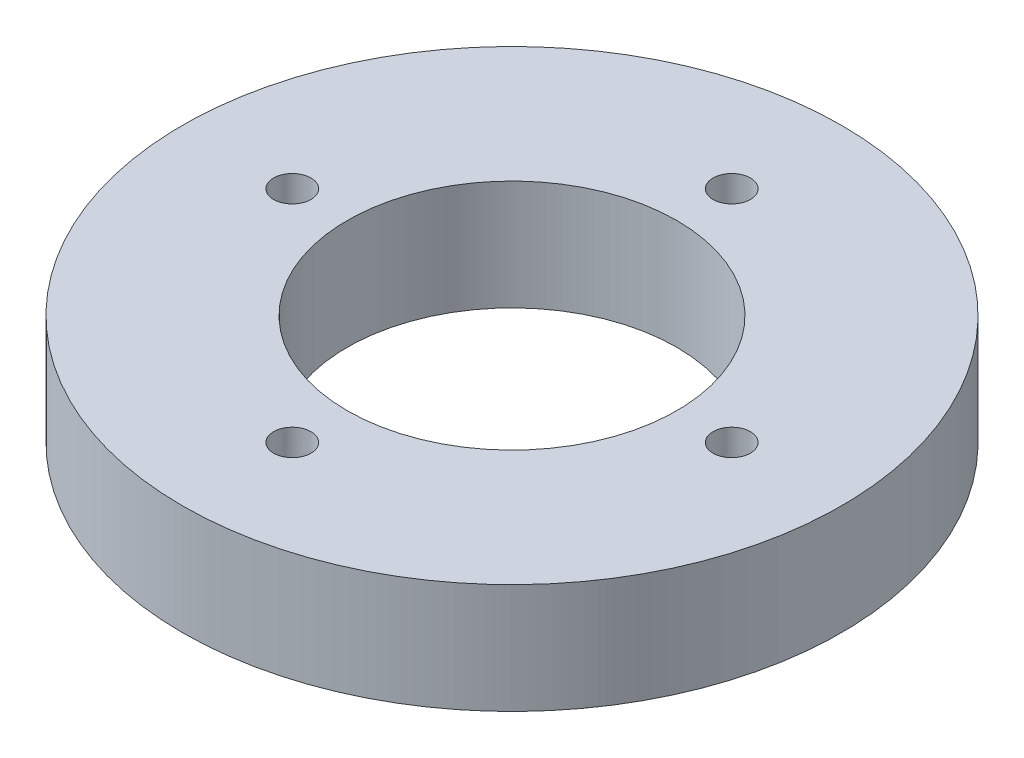
from build123d import *

# Parameters (mm, degrees)
SKETCH1_R           = 30
SKETCH1_R_2         = 15
BOSS_EXTRUDE1_DEPTH = 10
SKETCH2_R           = 1.7
CUT_EXTRUDE1_DEPTH  = 44.588989435
CUT_EXTRUDE2_DEPTH  = 3
CIRPATTERN1_COUNT   = 4


with BuildPart() as part:
    # Sketch1 → Boss-Extrude1 (new body)
    with BuildSketch(Plane(origin=(0, 0, 0), x_dir=(1, 0, 0), z_dir=(0, 1, 0))):
        with Locations(Location((0, 0, 0), (0, 0, 270))):
            Circle(SKETCH1_R)
        with Locations(Location((0, 0, 0), (0, 0, 270))):
            Circle(SKETCH1_R_2, mode=Mode.SUBTRACT)
    extrude(amount=BOSS_EXTRUDE1_DEPTH)

    # Sketch2 → Cut-Extrude1 (cut, through all)
    with BuildSketch(Plane(origin=(0, 10, 0), x_dir=(1, 0, 0), z_dir=(0, 1, 0))):
        with Locations(Location((0, -20, 0), (0, 0, 270))):
            Circle(SKETCH2_R)
    cut_extrude1 = extrude(amount=-CUT_EXTRUDE1_DEPTH, mode=Mode.SUBTRACT)

    # Sketch3 → Cut-Extrude2 (cut)
    with BuildSketch(Plane.XZ):
        Polygon((3.464101615, 20), (1.732050808, 23), (-1.732050808, 23), (-3.464101615, 20), (-1.732050808, 17), (1.732050808, 17), align=None)
    cut_extrude2 = extrude(amount=-CUT_EXTRUDE2_DEPTH, mode=Mode.SUBTRACT)

    # CirPattern1: Cut-Extrude1, Cut-Extrude2 ×4 about axis
    cirpattern1_axis = Axis((0, 0, 0), (0, 1, 0))
    add([cut_extrude1.rotate(cirpattern1_axis, i * 360 / CIRPATTERN1_COUNT) for i in range(1, CIRPATTERN1_COUNT)], mode=Mode.SUBTRACT)
    add([cut_extrude2.rotate(cirpattern1_axis, i * 360 / CIRPATTERN1_COUNT) for i in range(1, CIRPATTERN1_COUNT)], mode=Mode.SUBTRACT)


solid = part.part
